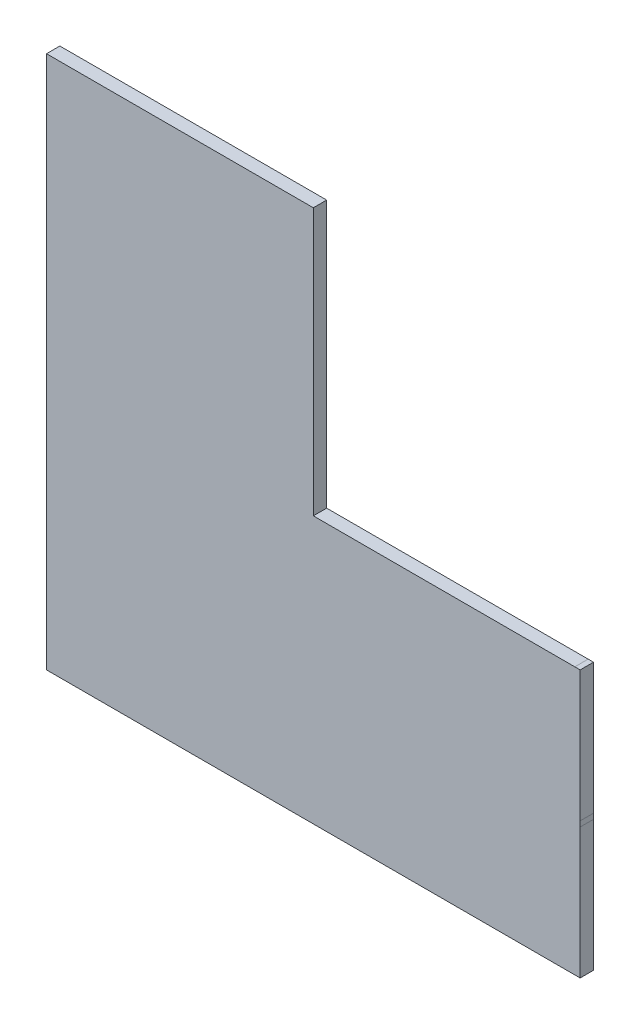
from build123d import *

# Parameters (mm, degrees)
BOSS_EXTRUDE1_DEPTH = 25


with BuildPart() as part:
    # Sketch1 → Boss-Extrude1 (new body)
    with BuildSketch(Plane.XY):
        Polygon((0, 0), (1000, 0), (1000, 500), (500, 500), (500, 1000), (0, 1000), align=None)
    extrude(amount=BOSS_EXTRUDE1_DEPTH)


solid = part.part
